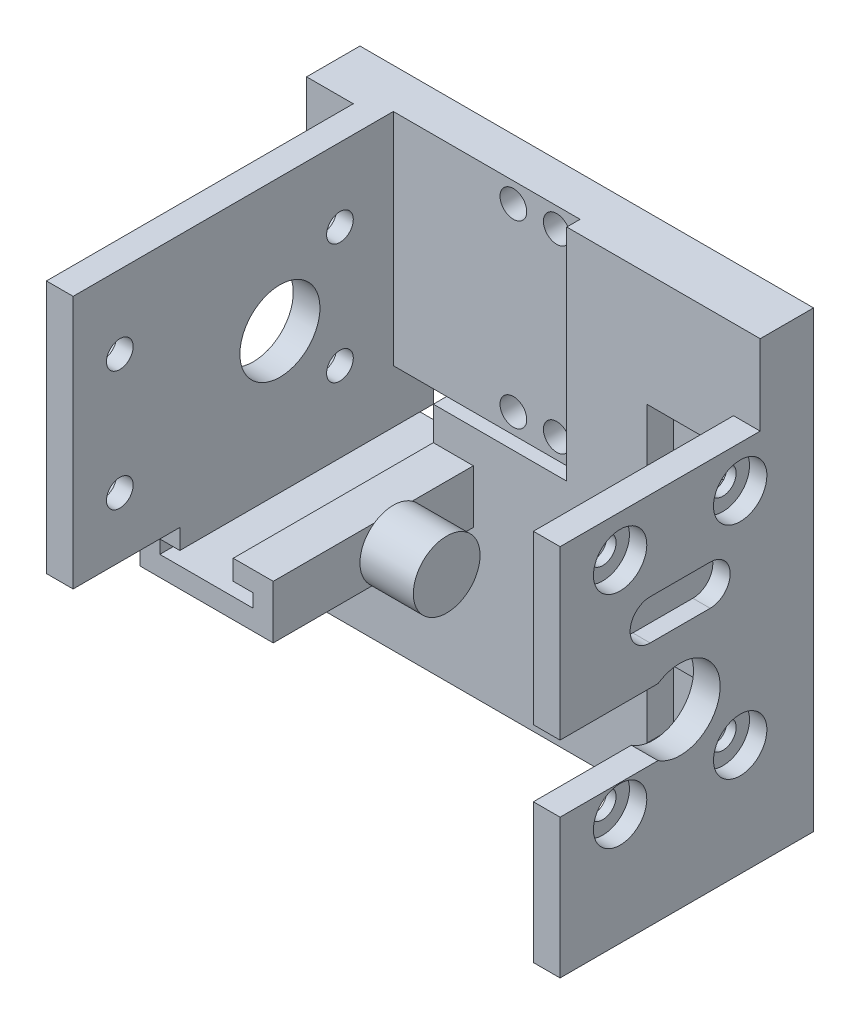
from build123d import *

# Parameters (mm, degrees)
SKETCH1_W               = 68
SKETCH1_H               = 60
BOSS_EXTRUDE1_DEPTH     = 8
BOSS_EXTRUDE2_DEPTH     = 30
CUT_EXTRUDE1_DEPTH      = 96.51963149
CUT_EXTRUDE1_DEPTH_BACK = 96.51963149
SKETCH4_W               = 14
SKETCH4_H               = 8
CUT_EXTRUDE2_DEPTH      = 30
SKETCH9_R               = 5
BOSS_EXTRUDE4_DEPTH     = 8
SKETCH10_W              = 68
SKETCH10_H              = 8
BOSS_EXTRUDE5_DEPTH     = 8
SKETCH6_W               = 12
SKETCH6_H               = 12
CUT_EXTRUDE7_DEPTH      = 4
SKETCH11_W              = 4
SKETCH11_H              = 68
BOSS_EXTRUDE6_DEPTH     = 30
CUT_EXTRUDE8_REACH      = 81.177
SKETCH13_R              = 5
SKETCH14_R              = 4
CUT_EXTRUDE9_DEPTH      = 2.6
CUT_EXTRUDE10_REACH     = 100.326
SKETCH17_R              = 2
CUT_EXTRUDE11_REACH     = 100.326
CUT_EXTRUDE12_REACH     = 98.85
SKETCH19_R              = 2.5
SKETCH20_W              = 4
SKETCH20_H              = 12
CUT_EXTRUDE13_DEPTH     = 30
CUT_EXTRUDE14_DEPTH     = 4
CUT_EXTRUDE15_REACH     = 98.85
SKETCH23_R              = 2
SKETCH24_W              = 4
SKETCH24_H              = 38
BOSS_EXTRUDE7_DEPTH     = 46
SKETCH25_R              = 6
CUT_EXTRUDE16_DEPTH     = 20
SKETCH27_W              = 28
SKETCH27_H              = 2
CUT_EXTRUDE18_DEPTH     = 33
SKETCH28_R              = 3
CUT_EXTRUDE19_DEPTH     = 1.5
CUT_EXTRUDE20_REACH     = 100.818
SKETCH29_R              = 2
CUT_EXTRUDE21_REACH     = 104.606
SKETCH30_R              = 2
SKETCH33_W              = 5
SKETCH33_H              = 5
BOSS_EXTRUDE9_DEPTH     = 2
BOSS_EXTRUDE9_2_DEPTH   = 2
SKETCH34_R              = 1.5
CUT_EXTRUDE23_DEPTH     = 2
SKETCH35_W              = 5
SKETCH35_H              = 5
BOSS_EXTRUDE10_DEPTH    = 2
SKETCH36_R              = 1.5
CUT_EXTRUDE24_DEPTH     = 2


with BuildPart() as part:
    # Sketch1 → Boss-Extrude1 (new body)
    with BuildSketch(Plane.XY):
        with Locations((34, 30)):
            Rectangle(SKETCH1_W, SKETCH1_H)
    extrude(amount=BOSS_EXTRUDE1_DEPTH)

    # Sketch3 → Boss-Extrude2 (add)
    with BuildSketch(Plane.XY.offset(8)):
        Polygon((25, 14), (25, 22), (22, 22), (22, 30), (8, 30), (8, 22), (5, 22), (5, 14), align=None)
    extrude(amount=BOSS_EXTRUDE2_DEPTH)

    # Sketch2 → Cut-Extrude1 (cut, two sides: drawn at the far end of the back side and taken through both)
    with BuildSketch(Plane.XY.offset(8).offset(-CUT_EXTRUDE1_DEPTH_BACK)):
        Polygon((11, 27), (11, 19), (8, 19), (8, 17), (22, 17), (22, 19), (19, 19), (19, 27), align=None)
    extrude(amount=CUT_EXTRUDE1_DEPTH + CUT_EXTRUDE1_DEPTH_BACK, mode=Mode.SUBTRACT)

    # Sketch4 → Cut-Extrude2 (cut)
    with BuildSketch(Plane.XY.offset(38)):
        with Locations((15, 26)):
            Rectangle(SKETCH4_W, SKETCH4_H)
    extrude(amount=-CUT_EXTRUDE2_DEPTH, mode=Mode.SUBTRACT)

    # Sketch9 → Boss-Extrude4 (add)
    with BuildSketch(Plane(origin=(25, 0, 0), x_dir=(0, 0, -1), z_dir=(1, 0, 0))):
        with Locations(Location((-20, 17.881070059, 0), (0, 0, 230.915229081))):
            Circle(SKETCH9_R)
    extrude(amount=BOSS_EXTRUDE4_DEPTH)

    # Sketch10 → Boss-Extrude5 (add)
    with BuildSketch(Plane.XZ):
        with Locations((34, 4)):
            Rectangle(SKETCH10_W, SKETCH10_H)
    extrude(amount=BOSS_EXTRUDE5_DEPTH)

    # Sketch6 → Cut-Extrude7 (cut)
    with BuildSketch(Plane.XY.offset(8)):
        with Locations((57, 37)):
            Rectangle(SKETCH6_W, SKETCH6_H)
        with Locations((57, 5)):
            Rectangle(SKETCH6_W, SKETCH6_H)
    extrude(amount=-CUT_EXTRUDE7_DEPTH, mode=Mode.SUBTRACT)

    # Sketch11 → Boss-Extrude6 (add)
    with BuildSketch(Plane.XY.offset(8)):
        with Locations((66, 26)):
            Rectangle(SKETCH11_W, SKETCH11_H)
    extrude(amount=BOSS_EXTRUDE6_DEPTH)

    # Sketch13 → Cut-Extrude8 (cut, up to next)
    with BuildSketch(Plane(origin=(33, 0, 0), x_dir=(0, 0, -1), z_dir=(1, 0, 0)), mode=Mode.PRIVATE) as cut_extrude8_sk1:
        with Locations(Location((-20, 17.881070059, 0), (0, 0, 230.915229081))):
            Circle(SKETCH13_R)
    cut_extrude8_tool1 = extrude(cut_extrude8_sk1.sketch, amount=CUT_EXTRUDE8_REACH, mode=Mode.PRIVATE) & part.part
    add(cut_extrude8_tool1.solids().sort_by_distance((33, 17.88107, 20))[0], mode=Mode.SUBTRACT)

    # Sketch14 → Cut-Extrude9 (cut)
    with BuildSketch(Plane(origin=(68, 0, 0), x_dir=(0, 0, -1), z_dir=(1, 0, 0))):
        with Locations(Location((-29, 8.75, 0), (0, 0, 90))):
            Circle(SKETCH14_R)
        with Locations(Location((-11, 8.75, 0), (0, 0, 90))):
            Circle(SKETCH14_R)
        with Locations(Location((-11, 41.75, 0), (0, 0, 90))):
            Circle(SKETCH14_R)
        with Locations(Location((-29, 41.75, 0), (0, 0, 90))):
            Circle(SKETCH14_R)
        with BuildLine():
            Line((-24.5, 34.75), (-15.5, 34.75))
            ThreePointArc((-15.5, 34.75), (-12.5, 31.75), (-15.5, 28.75))
            Line((-15.5, 28.75), (-24.5, 28.75))
            ThreePointArc((-24.5, 28.75), (-27.5, 31.75), (-24.5, 34.75))
        make_face()
    extrude(amount=-CUT_EXTRUDE9_DEPTH, mode=Mode.SUBTRACT)

    # Sketch17 → Cut-Extrude10 (cut, up to next)
    with BuildSketch(Plane(origin=(68, 0, 0), x_dir=(0, 0, -1), z_dir=(1, 0, 0)), mode=Mode.PRIVATE) as cut_extrude10_sk1:
        with Locations(Location((-11, 41.75, 0), (0, 0, 90))):
            Circle(SKETCH17_R)
    cut_extrude10_tool1 = extrude(cut_extrude10_sk1.sketch, amount=-CUT_EXTRUDE10_REACH, mode=Mode.PRIVATE) & part.part
    # Sketch17 → Cut-Extrude10 (cut, up to next)
    with BuildSketch(Plane(origin=(68, 0, 0), x_dir=(0, 0, -1), z_dir=(1, 0, 0)), mode=Mode.PRIVATE) as cut_extrude10_sk2:
        with Locations(Location((-11, 8.75, 0), (0, 0, 90))):
            Circle(SKETCH17_R)
    cut_extrude10_tool2 = extrude(cut_extrude10_sk2.sketch, amount=-CUT_EXTRUDE10_REACH, mode=Mode.PRIVATE) & part.part
    # Sketch17 → Cut-Extrude10 (cut, up to next)
    with BuildSketch(Plane(origin=(68, 0, 0), x_dir=(0, 0, -1), z_dir=(1, 0, 0)), mode=Mode.PRIVATE) as cut_extrude10_sk3:
        with Locations(Location((-29, 8.75, 0), (0, 0, 90))):
            Circle(SKETCH17_R)
    cut_extrude10_tool3 = extrude(cut_extrude10_sk3.sketch, amount=-CUT_EXTRUDE10_REACH, mode=Mode.PRIVATE) & part.part
    # Sketch17 → Cut-Extrude10 (cut, up to next)
    with BuildSketch(Plane(origin=(68, 0, 0), x_dir=(0, 0, -1), z_dir=(1, 0, 0)), mode=Mode.PRIVATE) as cut_extrude10_sk4:
        with Locations(Location((-29, 41.75, 0), (0, 0, 90))):
            Circle(SKETCH17_R)
    cut_extrude10_tool4 = extrude(cut_extrude10_sk4.sketch, amount=-CUT_EXTRUDE10_REACH, mode=Mode.PRIVATE) & part.part
    add(cut_extrude10_tool1.solids().sort_by_distance((68, 41.75, 11))[0], mode=Mode.SUBTRACT)
    add(cut_extrude10_tool2.solids().sort_by_distance((68, 8.75, 11))[0], mode=Mode.SUBTRACT)
    add(cut_extrude10_tool3.solids().sort_by_distance((68, 8.75, 29))[0], mode=Mode.SUBTRACT)
    add(cut_extrude10_tool4.solids().sort_by_distance((68, 41.75, 29))[0], mode=Mode.SUBTRACT)

    # Sketch18 → Cut-Extrude11 (cut, up to next)
    with BuildSketch(Plane(origin=(68, 0, 0), x_dir=(0, 0, -1), z_dir=(1, 0, 0)), mode=Mode.PRIVATE) as cut_extrude11_sk1:
        with BuildLine():
            Line((-44, 22.881070059), (-44, 12.881070059))
            Line((-44, 12.881070059), (-23.31662479, 12.881070059))
            ThreePointArc((-23.31662479, 12.881070059), (-14, 17.881070059), (-23.31662479, 22.881070059))
            Line((-23.31662479, 22.881070059), (-44, 22.881070059))
        make_face()
    cut_extrude11_tool1 = extrude(cut_extrude11_sk1.sketch, amount=-CUT_EXTRUDE11_REACH, mode=Mode.PRIVATE) & part.part
    add(cut_extrude11_tool1.solids().sort_by_distance((68, 17.88107, 29.107008))[0], mode=Mode.SUBTRACT)

    # Sketch19 → Cut-Extrude12 (cut, up to next)
    with BuildSketch(Plane.XY.offset(4), mode=Mode.PRIVATE) as cut_extrude12_sk1:
        with Locations((57, 5)):
            Circle(SKETCH19_R)
    cut_extrude12_tool1 = extrude(cut_extrude12_sk1.sketch, amount=-CUT_EXTRUDE12_REACH, mode=Mode.PRIVATE) & part.part
    # Sketch19 → Cut-Extrude12 (cut, up to next)
    with BuildSketch(Plane.XY.offset(4), mode=Mode.PRIVATE) as cut_extrude12_sk2:
        with Locations((57, 37)):
            Circle(SKETCH19_R)
    cut_extrude12_tool2 = extrude(cut_extrude12_sk2.sketch, amount=-CUT_EXTRUDE12_REACH, mode=Mode.PRIVATE) & part.part
    add(cut_extrude12_tool1.solids().sort_by_distance((57, 5, 4))[0], mode=Mode.SUBTRACT)
    add(cut_extrude12_tool2.solids().sort_by_distance((57, 37, 4))[0], mode=Mode.SUBTRACT)

    # Sketch20 → Cut-Extrude13 (cut)
    with BuildSketch(Plane.XY.offset(38)):
        with Locations((66, 54)):
            Rectangle(SKETCH20_W, SKETCH20_H)
    extrude(amount=-CUT_EXTRUDE13_DEPTH, mode=Mode.SUBTRACT)

    # Sketch22 → Cut-Extrude14 (cut)
    with BuildSketch(Plane(origin=(0, 0, 0), x_dir=(-1, 0, 0), z_dir=(0, 0, -1))):
        Polygon((-31.5, 17.5), (-34, 21.830127019), (-39, 21.830127019), (-41.5, 17.5), (-39, 13.169872981), (-34, 13.169872981), align=None)
    extrude(amount=-CUT_EXTRUDE14_DEPTH, mode=Mode.SUBTRACT)

    # Sketch23 → Cut-Extrude15 (cut, up to next)
    with BuildSketch(Plane(origin=(0, 0, 4), x_dir=(-1, 0, 0), z_dir=(0, 0, -1)), mode=Mode.PRIVATE) as cut_extrude15_sk1:
        with Locations((-36.5, 17.5)):
            Circle(SKETCH23_R)
    cut_extrude15_tool1 = extrude(cut_extrude15_sk1.sketch, amount=-CUT_EXTRUDE15_REACH, mode=Mode.PRIVATE) & part.part
    add(cut_extrude15_tool1.solids().sort_by_distance((36.5, 17.5, 4))[0], mode=Mode.SUBTRACT)

    # Sketch24 → Boss-Extrude7 (add)
    with BuildSketch(Plane.XY.offset(8)):
        with Locations((9, 41)):
            Rectangle(SKETCH24_W, SKETCH24_H)
    extrude(amount=BOSS_EXTRUDE7_DEPTH)

    # Sketch25 → Cut-Extrude16 (cut)
    with BuildSketch(Plane.ZY.offset(-5)):
        with Locations(Location((23, 40, 0), (0, 0, 270))):
            Circle(SKETCH25_R)
    extrude(amount=-CUT_EXTRUDE16_DEPTH, mode=Mode.SUBTRACT)

    # Sketch27 → Cut-Extrude18 (cut)
    with BuildSketch(Plane(origin=(0, 60, 0), x_dir=(1, 0, 0), z_dir=(0, 1, 0))):
        with Locations((25, -7)):
            Rectangle(SKETCH27_W, SKETCH27_H)
    extrude(amount=-CUT_EXTRUDE18_DEPTH, mode=Mode.SUBTRACT)

    # Sketch28 → Cut-Extrude19 (cut)
    with BuildSketch(Plane.ZY.offset(-7)):
        with Locations(Location((14, 49, 0), (0, 0, 270))):
            Circle(SKETCH28_R)
        with Locations(Location((14, 31, 0), (0, 0, 270))):
            Circle(SKETCH28_R)
        with Locations(Location((47, 49, 0), (0, 0, 270))):
            Circle(SKETCH28_R)
        with Locations(Location((47, 31, 0), (0, 0, 270))):
            Circle(SKETCH28_R)
        with BuildLine():
            Line((40, 44.5), (40, 35.5))
            ThreePointArc((40, 35.5), (37, 32.5), (34, 35.5))
            Line((34, 35.5), (34, 44.5))
            ThreePointArc((34, 44.5), (37, 47.5), (40, 44.5))
        make_face()
    extrude(amount=-CUT_EXTRUDE19_DEPTH, mode=Mode.SUBTRACT)

    # Sketch29 → Cut-Extrude20 (cut, up to next)
    with BuildSketch(Plane(origin=(11, 0, 0), x_dir=(0, 0, -1), z_dir=(1, 0, 0)), mode=Mode.PRIVATE) as cut_extrude20_sk1:
        with Locations(Location((-47, 49, 0), (0, 0, 90))):
            Circle(SKETCH29_R)
    cut_extrude20_tool1 = extrude(cut_extrude20_sk1.sketch, amount=-CUT_EXTRUDE20_REACH, mode=Mode.PRIVATE) & part.part
    # Sketch29 → Cut-Extrude20 (cut, up to next)
    with BuildSketch(Plane(origin=(11, 0, 0), x_dir=(0, 0, -1), z_dir=(1, 0, 0)), mode=Mode.PRIVATE) as cut_extrude20_sk2:
        with Locations(Location((-47, 31, 0), (0, 0, 90))):
            Circle(SKETCH29_R)
    cut_extrude20_tool2 = extrude(cut_extrude20_sk2.sketch, amount=-CUT_EXTRUDE20_REACH, mode=Mode.PRIVATE) & part.part
    # Sketch29 → Cut-Extrude20 (cut, up to next)
    with BuildSketch(Plane(origin=(11, 0, 0), x_dir=(0, 0, -1), z_dir=(1, 0, 0)), mode=Mode.PRIVATE) as cut_extrude20_sk3:
        with Locations(Location((-14, 49, 0), (0, 0, 90))):
            Circle(SKETCH29_R)
    cut_extrude20_tool3 = extrude(cut_extrude20_sk3.sketch, amount=-CUT_EXTRUDE20_REACH, mode=Mode.PRIVATE) & part.part
    # Sketch29 → Cut-Extrude20 (cut, up to next)
    with BuildSketch(Plane(origin=(11, 0, 0), x_dir=(0, 0, -1), z_dir=(1, 0, 0)), mode=Mode.PRIVATE) as cut_extrude20_sk4:
        with Locations(Location((-14, 31, 0), (0, 0, 90))):
            Circle(SKETCH29_R)
    cut_extrude20_tool4 = extrude(cut_extrude20_sk4.sketch, amount=-CUT_EXTRUDE20_REACH, mode=Mode.PRIVATE) & part.part
    add(cut_extrude20_tool1.solids().sort_by_distance((11, 49, 47))[0], mode=Mode.SUBTRACT)
    add(cut_extrude20_tool2.solids().sort_by_distance((11, 31, 47))[0], mode=Mode.SUBTRACT)
    add(cut_extrude20_tool3.solids().sort_by_distance((11, 49, 14))[0], mode=Mode.SUBTRACT)
    add(cut_extrude20_tool4.solids().sort_by_distance((11, 31, 14))[0], mode=Mode.SUBTRACT)

    # Sketch30 → Cut-Extrude21 (cut, up to next)
    with BuildSketch(Plane.XY.offset(6), mode=Mode.PRIVATE) as cut_extrude21_sk1:
        with Locations((29, 30)):
            Circle(SKETCH30_R)
    cut_extrude21_tool1 = extrude(cut_extrude21_sk1.sketch, amount=-CUT_EXTRUDE21_REACH, mode=Mode.PRIVATE) & part.part
    # Sketch30 → Cut-Extrude21 (cut, up to next)
    with BuildSketch(Plane.XY.offset(6), mode=Mode.PRIVATE) as cut_extrude21_sk2:
        with Locations((29, 57)):
            Circle(SKETCH30_R)
    cut_extrude21_tool2 = extrude(cut_extrude21_sk2.sketch, amount=-CUT_EXTRUDE21_REACH, mode=Mode.PRIVATE) & part.part
    # Sketch30 → Cut-Extrude21 (cut, up to next)
    with BuildSketch(Plane.XY.offset(6), mode=Mode.PRIVATE) as cut_extrude21_sk3:
        with Locations((35.5, 30)):
            Circle(SKETCH30_R)
    cut_extrude21_tool3 = extrude(cut_extrude21_sk3.sketch, amount=-CUT_EXTRUDE21_REACH, mode=Mode.PRIVATE) & part.part
    # Sketch30 → Cut-Extrude21 (cut, up to next)
    with BuildSketch(Plane.XY.offset(6), mode=Mode.PRIVATE) as cut_extrude21_sk4:
        with Locations((35.5, 57)):
            Circle(SKETCH30_R)
    cut_extrude21_tool4 = extrude(cut_extrude21_sk4.sketch, amount=-CUT_EXTRUDE21_REACH, mode=Mode.PRIVATE) & part.part
    add(cut_extrude21_tool1.solids().sort_by_distance((29, 30, 6))[0], mode=Mode.SUBTRACT)
    add(cut_extrude21_tool2.solids().sort_by_distance((29, 57, 6))[0], mode=Mode.SUBTRACT)
    add(cut_extrude21_tool3.solids().sort_by_distance((35.5, 30, 6))[0], mode=Mode.SUBTRACT)
    add(cut_extrude21_tool4.solids().sort_by_distance((35.5, 57, 6))[0], mode=Mode.SUBTRACT)

    # Sketch35 → Boss-Extrude10 (add)
    with BuildSketch(Plane(origin=(0, -8, 0), x_dir=(-1, 0, 0), z_dir=(0, -1, 0))):
        with Locations((-2.5, 2.5)):
            Rectangle(SKETCH35_W, SKETCH35_H)
        with Locations((-18.5, 2.5)):
            Rectangle(SKETCH35_W, SKETCH35_H)
    extrude(amount=-BOSS_EXTRUDE10_DEPTH)

    # Sketch36 → Cut-Extrude24 (cut)
    with BuildSketch(Plane(origin=(0, -8, 0), x_dir=(-1, 0, 0), z_dir=(0, -1, 0))):
        with Locations(Location((-2.5, 2.5, 0), (0, 0, 180))):
            Circle(SKETCH36_R)
        with Locations(Location((-18.5, 2.5, 0), (0, 0, 180))):
            Circle(SKETCH36_R)
    extrude(amount=-CUT_EXTRUDE24_DEPTH, mode=Mode.SUBTRACT)


with BuildPart() as body_2:
    # Sketch33 → Boss-Extrude9 (new body)
    with BuildSketch(Plane.ZY):
        with Locations((-2.5, 20.5)):
            Rectangle(SKETCH33_W, SKETCH33_H)
    extrude(amount=-BOSS_EXTRUDE9_DEPTH)


with BuildPart() as body_3:
    # Sketch33 → Boss-Extrude9 2 (new body)
    with BuildSketch(Plane.ZY):
        with Locations((-2.5, 4.5)):
            Rectangle(SKETCH33_W, SKETCH33_H)
    extrude(amount=-BOSS_EXTRUDE9_2_DEPTH)


with BuildPart() as cut_extrude23_tool:
    # Sketch34 → Cut-Extrude23 (new body)
    with BuildSketch(Plane.ZY):
        with Locations((-2.5, 20.5)):
            Circle(SKETCH34_R)
        with Locations((-2.5, 4.5)):
            Circle(SKETCH34_R)
    extrude(amount=-CUT_EXTRUDE23_DEPTH)


with BuildPart() as body_2_1:
    add(body_2.part)

    # Cut-Extrude23: cut by cut_extrude23_tool
    add(cut_extrude23_tool.part, mode=Mode.SUBTRACT)


with BuildPart() as body_3_1:
    add(body_3.part)

    # Cut-Extrude23: cut by cut_extrude23_tool
    add(cut_extrude23_tool.part, mode=Mode.SUBTRACT)


solid = Compound([part.part, body_2_1.part, body_3_1.part])
